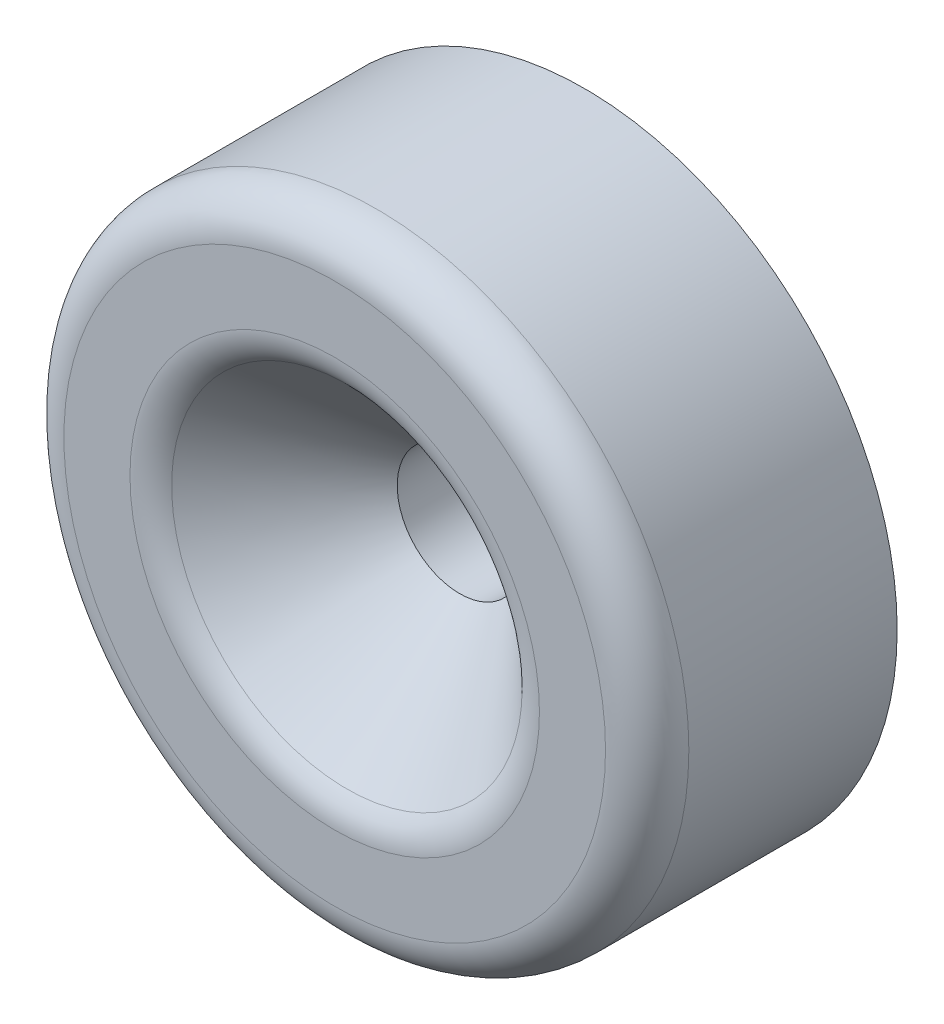
from build123d import *

# Parameters (mm, degrees)
ESQUISSE1_R        = 15
ESQUISSE1_R_2      = 3
BOSS_EXTRU_1_DEPTH = 12
CHANFREIN1_SIZE    = 6
CONG_1_R           = 2


with BuildPart() as part:
    # Esquisse1 → Boss.-Extru.1 (new body)
    with BuildSketch(Plane.XY):
        Circle(ESQUISSE1_R)
        Circle(ESQUISSE1_R_2, mode=Mode.SUBTRACT)
    extrude(amount=BOSS_EXTRU_1_DEPTH)

    # Chanfrein1
    chanfrein1_edges = [part.edges().sort_by_distance(p)[0] for p in [
        (-3, 0, 12),
    ]]
    chamfer(chanfrein1_edges, length=CHANFREIN1_SIZE)

    # Congé1
    cong_1_edges = [part.edges().sort_by_distance(p)[0] for p in [
        (-9, 0, 12),
        (-15, 0, 12),
    ]]
    fillet(cong_1_edges, radius=CONG_1_R)


solid = part.part
